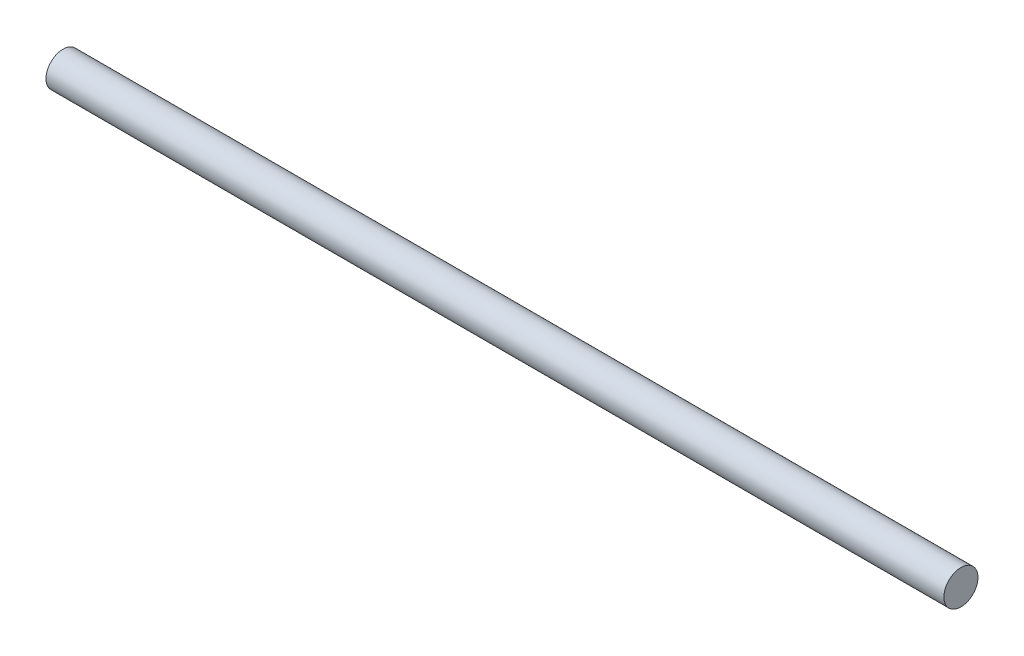
from build123d import *

# Parameters (mm, degrees)
SKETCH1_R           = 19
BOSS_EXTRUDE1_DEPTH = 1000


with BuildPart() as part:
    # Sketch1 → Boss-Extrude1 (new body)
    with BuildSketch(Plane(origin=(0, 0, 0), x_dir=(0, 0, -1), z_dir=(1, 0, 0))):
        Circle(SKETCH1_R)
    extrude(amount=BOSS_EXTRUDE1_DEPTH)


solid = part.part
